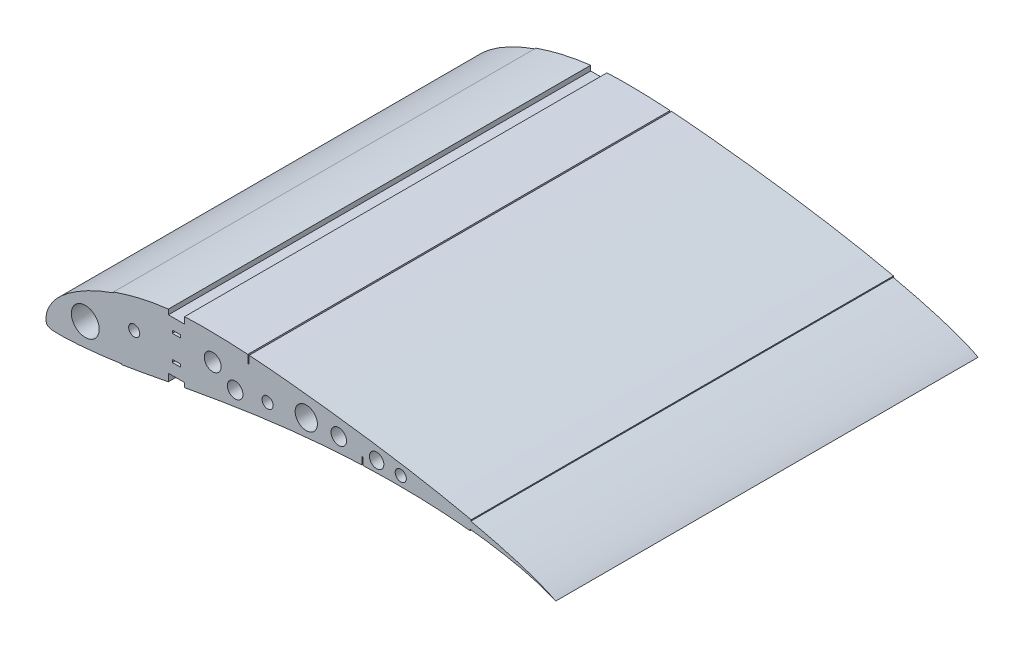
from build123d import *

# Parameters (mm, degrees)
BOSS_EXTRUDE1_DEPTH = 482.6
SKETCH2_R           = 15.90675
SKETCH2_W           = 9.525
SKETCH2_H           = 3.175
SKETCH2_W_2         = 18.415
SKETCH2_H_2         = 15.85559798
SKETCH2_H_3         = 15.855597979
SKETCH2_W_3         = 1.5875
SKETCH2_H_4         = 26.184180919
SKETCH2_H_5         = 17.627877955
CUT_EXTRUDE1_DEPTH  = 774.852233684
CUT_EXTRUDE2_DEPTH  = 774.852233684
SKETCH4_R           = 6.35
CUT_EXTRUDE3_DEPTH  = 254
SKETCH5_R           = 9.652
CUT_EXTRUDE4_DEPTH  = 762.304473176
SKETCH6_R           = 12.7
SKETCH6_R_2         = 8.89
SKETCH6_R_3         = 6.35
SKETCH6_R_4         = 8.255
CUT_EXTRUDE5_DEPTH  = 482.6


with BuildPart() as part:
    # Sketch1 → Boss-Extrude1 (new body)
    with BuildSketch(Plane.XY):
        with BuildLine():
            add(Edge.make_bspline(
                [(0.029973499, 1.067056553), (0.025482716, -0.399193593), (0.017346446, -3.055703366), (1.185340338, -7.066714799), (5.359349092, -9.058219245), (10.992299899, -9.337536048), (18.688970438, -9.608340666), (28.37164591, -9.190828627), (39.926779162, -8.423591432), (53.227271889, -7.19463679), (68.136511644, -5.531810338), (84.581964002, -3.399428713), (102.555539625, -0.419108309), (122.144766621, 3.318165226), (143.447572924, 7.385511412), (166.359833686, 11.680045868), (190.73763535, 16.023516172), (216.401946607, 20.252916976), (243.153661901, 24.227017525), (270.762236213, 27.800033502), (298.979393294, 30.867927352), (327.538585791, 33.292970979), (356.153214192, 35.012028405), (384.524332697, 35.957087661), (412.344151304, 36.076461373), (439.30234347, 35.362005472), (465.090056075, 33.83056325), (489.397768518, 31.501486873), (511.934144855, 28.465549934), (532.412164246, 24.806307195), (550.571231532, 20.660836314), (566.139870099, 16.190419061), (578.750416216, 11.518597391), (588.074753783, 6.996082262), (594.221404373, 3.366213471), (597.671198487, 1.186058119), (599.120636969, 0.230341997), (599.469973499, 0)],
                knots=[0, 0, 0, 0, 0.007209958, 0.013062794, 0.018988106, 0.028118167, 0.040671281, 0.056472504, 0.075356327, 0.097132941, 0.121590611, 0.148498573, 0.177976563, 0.210404303, 0.245731274, 0.283719641, 0.324062539, 0.366459866, 0.410534862, 0.455920904, 0.502185378, 0.548913178, 0.595654637, 0.641938473, 0.687301348, 0.731276985, 0.773403195, 0.813231176, 0.850309728, 0.884246489, 0.914622893, 0.941087891, 0.963171226, 0.980103797, 0.99153504, 0.997959817, 1, 1, 1, 1], degree=3))
            add(Edge.make_bspline(
                [(599.469973499, 0), (599.144367325, 0.249450159), (597.931629482, 1.178540797), (595.605930115, 3.282660064), (592.221856313, 6.473044338), (587.740102166, 10.189005153), (581.807923008, 13.823571972), (574.367601568, 17.383329981), (565.406953288, 21.084642776), (554.914604497, 24.893738904), (542.947936723, 28.777714393), (529.566323654, 32.704801784), (514.845570483, 36.655948851), (498.866688674, 40.595068593), (481.721371411, 44.49358753), (463.511784491, 48.327172983), (444.349131312, 52.07611226), (424.345406885, 55.694273937), (403.626579023, 59.176488272), (382.312051813, 62.47791518), (360.5396669, 65.605001309), (338.448959271, 68.532966072), (316.199932026, 71.252440139), (293.970449261, 73.78267886), (271.944537985, 76.059837779), (250.301639925, 78.041297276), (229.193973537, 79.615529991), (208.742113562, 80.698400053), (189.059840382, 81.1660338), (170.247983484, 81.116257243), (152.341634259, 80.195173727), (135.33385627, 78.328639474), (119.155414684, 75.689332361), (103.802404732, 72.270133295), (89.290599696, 68.260645439), (75.681399759, 63.73188295), (63.032687245, 58.789751147), (51.423050257, 53.460727999), (40.88976259, 47.853008536), (31.489987555, 42.03036159), (23.283138112, 36.071694919), (16.271085356, 30.103290726), (10.560360723, 24.060060491), (6.16261814, 17.994144061), (2.949517004, 12.093286108), (0.781951142, 6.489230076), (0.268908684, 2.789911015), (0.029973499, 1.067056553)],
                knots=[0, 0, 0, 0, 0.00192076, 0.007153976, 0.014672181, 0.023714055, 0.034360752, 0.047156029, 0.062313993, 0.079753134, 0.099422845, 0.121230508, 0.145063659, 0.170804284, 0.19830544, 0.227411767, 0.257957563, 0.289754565, 0.322619271, 0.356355351, 0.39077192, 0.425637579, 0.460722904, 0.495752348, 0.530423111, 0.564432121, 0.597540179, 0.629552894, 0.66034349, 0.689740734, 0.717642157, 0.744276208, 0.769837174, 0.794378837, 0.81790915, 0.840321993, 0.861526798, 0.881481099, 0.900117612, 0.9173823, 0.933224814, 0.947577749, 0.960450174, 0.972074093, 0.982555802, 0.991875852, 1, 1, 1, 1], degree=3))
        make_face()
    extrude(amount=BOSS_EXTRUDE1_DEPTH)

    # Sketch2 → Cut-Extrude1 (cut, through all)
    with BuildSketch(Plane(origin=(0, 0, 0), x_dir=(-1, 0, 0), z_dir=(0, 0, -1))):
        with Locations((-45.71378729, 19.209848511)):
            Circle(SKETCH2_R)
        with Locations((-149.86, 29.810016665)):
            Rectangle(SKETCH2_W, SKETCH2_H)
        with Locations((-149.86, 58.702516665)):
            Rectangle(SKETCH2_W, SKETCH2_H)
        with Locations((-149.86, 81.076565655)):
            Rectangle(SKETCH2_W_2, SKETCH2_H_2)
        with Locations((-149.86, 7.435967676)):
            Rectangle(SKETCH2_W_2, SKETCH2_H_3)
        with Locations((-232.18747961, 83.393527242)):
            Rectangle(SKETCH2_W_3, SKETCH2_H_4)
        with Locations((-362.485490244, 34.872384381)):
            Rectangle(SKETCH2_W_3, SKETCH2_H_5)
    extrude(amount=-CUT_EXTRUDE1_DEPTH, mode=Mode.SUBTRACT)

    # Sketch3 → Cut-Extrude2 (cut, through all)
    with BuildSketch(Plane.XY.offset(482.6)):
        with BuildLine():
            Line((77.933363518, 64.40769414), (78.1966121, 63.658868896))
            add(Edge.make_bspline(
                [(78.1966121, 63.658868896), (69.985634715, 60.772310029), (57.85648004, 55.846821377), (42.39425412, 47.834243761), (31.274486162, 41.004476131), (22.548835264, 34.510035421), (16.086911154, 28.733774419), (11.633751842, 24.01691432), (7.707609371, 18.860846034), (4.966930306, 14.226368594), (3.135747429, 10.32099561), (1.997147939, 7.315528892), (1.27047453, 4.249927301), (0.972190725, 2.082717901), (0.823556195, 1.011070007)],
                knots=[0.836254434, 0.836254434, 0.836254434, 0.836254434, 0.877169975, 0.897627745, 0.918085516, 0.938543286, 0.948772171, 0.959001057, 0.969229942, 0.979458827, 0.98457327, 0.989687712, 0.994802155, 0.999916597, 0.999916597, 0.999916597, 0.999916597], degree=3))
            add(Edge.make_bspline(
                [(0.823556195, 1.011070007), (0.822091374, 0.528862935), (0.819913396, -0.441566223), (0.87157268, -1.861096925), (1.028055129, -3.276582803), (1.336185442, -4.670302036), (1.856743185, -5.858463257), (2.880773306, -6.997470088), (5.091116011, -7.9581819), (7.851572867, -8.398591779), (11.735386514, -8.55832663), (16.643083098, -8.744170691), (22.490379014, -8.659168544), (28.366630918, -8.365820179), (34.240832229, -8.005847755), (40.109049075, -7.570305899), (45.97314136, -7.064913806), (53.787366325, -6.312731784), (63.544629774, -5.253187973), (75.237867071, -3.828913976), (83.008612285, -2.739497215), (86.887378889, -2.146354327)],
                knots=[8.7815e-05, 8.7815e-05, 8.7815e-05, 8.7815e-05, 0.002482783, 0.004877751, 0.007272718, 0.009667686, 0.012062654, 0.014457622, 0.019247558, 0.024037493, 0.028827429, 0.0384073, 0.047987172, 0.057567043, 0.067146914, 0.076726786, 0.086306657, 0.095886528, 0.115046271, 0.134206014, 0.153365756, 0.153365756, 0.153365756, 0.153365756], degree=3))
            Line((86.887378889, -2.146354327), (87.007364719, -2.930983196))
            add(Edge.make_bspline(
                [(0.029973499, 1.067056553), (0.025482716, -0.399193593), (0.017346446, -3.055703366), (1.185340338, -7.066714799), (5.359349092, -9.058219245), (10.992299899, -9.337536048), (18.688970438, -9.608340666), (28.37164591, -9.190828627), (39.926779162, -8.423591432), (53.227271889, -7.19463679), (68.136511644, -5.531810338), (79.575559776, -4.048578651), (86.020570323, -3.081884278), (87.007364719, -2.930983196)],
                knots=[0, 0, 0, 0, 0.007209958, 0.013062794, 0.018988106, 0.028118167, 0.040671281, 0.056472504, 0.075356327, 0.097132941, 0.121590611, 0.148498573, 0.153365756, 0.153365756, 0.153365756, 0.153365756], degree=3))
            add(Edge.make_bspline(
                [(77.933363518, 64.40769414), (77.113954255, 64.119631835), (72.031295812, 62.305706588), (63.032687245, 58.789751147), (51.423050257, 53.460727999), (40.88976259, 47.853008536), (31.489987555, 42.03036159), (23.283138112, 36.071694919), (16.271085356, 30.103290726), (10.560360723, 24.060060491), (6.16261814, 17.994144061), (2.949517004, 12.093286108), (0.781951142, 6.489230076), (0.268908684, 2.789911015), (0.029973499, 1.067056553)],
                knots=[0.836254434, 0.836254434, 0.836254434, 0.836254434, 0.840321993, 0.861526798, 0.881481099, 0.900117612, 0.9173823, 0.933224814, 0.947577749, 0.960450174, 0.972074093, 0.982555802, 0.991875852, 1, 1, 1, 1], degree=3))
        make_face()
        with BuildLine():
            Line((485.418851182, 31.793724256), (485.590124506, 33.371957983))
            add(Edge.make_bspline(
                [(485.590124506, 33.371957983), (493.893465776, 32.4708615), (510.464701197, 30.345194792), (535.15972241, 25.955207479), (555.516587627, 21.069581755), (571.517101052, 15.995789217), (579.362594494, 12.850321402), (583.182193169, 11.072832852)],
                knots=[0.805836244, 0.805836244, 0.805836244, 0.805836244, 0.846446639, 0.887057035, 0.92766743, 0.947972628, 0.968277825, 0.968277825, 0.968277825, 0.968277825], degree=3))
            add(Edge.make_bspline(
                [(583.182193169, 11.072832852), (581.384043053, 12.138030428), (577.690909224, 14.07350548), (569.977761779, 17.545570046), (560.108694843, 21.399429663), (548.042734666, 25.506594035), (531.778461633, 30.488573444), (511.222512963, 36.021440493), (494.638437991, 39.939557935), (486.326207629, 41.799049062)],
                knots=[0.031056695, 0.031056695, 0.031056695, 0.031056695, 0.041047331, 0.051037967, 0.071019239, 0.091000512, 0.110981784, 0.150944329, 0.190906873, 0.190906873, 0.190906873, 0.190906873], degree=3))
            Line((486.326207629, 41.799049062), (486.672774064, 43.348257878))
            add(Edge.make_bspline(
                [(599.469973499, 0), (599.144367325, 0.249450159), (597.931629482, 1.178540797), (595.605930115, 3.282660064), (592.221856313, 6.473044338), (587.740102166, 10.189005153), (581.807923008, 13.823571972), (574.367601568, 17.383329981), (565.406953288, 21.084642776), (554.914604497, 24.893738904), (542.947936723, 28.777714393), (529.566323654, 32.704801784), (514.845570483, 36.655948851), (500.400531408, 40.216945125), (490.861393011, 42.411241045), (486.672774064, 43.348257878)],
                knots=[0, 0, 0, 0, 0.00192076, 0.007153976, 0.014672181, 0.023714055, 0.034360752, 0.047156029, 0.062313993, 0.079753134, 0.099422845, 0.121230508, 0.145063659, 0.170804284, 0.190906873, 0.190906873, 0.190906873, 0.190906873], degree=3))
            add(Edge.make_bspline(
                [(485.418851182, 31.793724256), (486.926775542, 31.630081056), (495.991973516, 30.613163469), (511.934144855, 28.465549934), (532.412164246, 24.806307195), (550.571231532, 20.660836314), (566.139870099, 16.190419061), (578.750416216, 11.518597391), (588.074753783, 6.996082262), (594.221404373, 3.366213471), (597.671198487, 1.186058119), (599.120636969, 0.230341997), (599.469973499, 0)],
                knots=[0.805836244, 0.805836244, 0.805836244, 0.805836244, 0.813231176, 0.850309728, 0.884246489, 0.914622893, 0.941087891, 0.963171226, 0.980103797, 0.99153504, 0.997959817, 1, 1, 1, 1], degree=3))
        make_face()
    extrude(amount=-CUT_EXTRUDE2_DEPTH, mode=Mode.SUBTRACT)

    # Sketch4 → Cut-Extrude3 (cut)
    with BuildSketch(Plane.XY.offset(482.6)):
        with Locations((101.6, 38.1)):
            Circle(SKETCH4_R)
        with Locations((254, 43.18)):
            Circle(SKETCH4_R)
    extrude(amount=-CUT_EXTRUDE3_DEPTH, mode=Mode.SUBTRACT)

    # Sketch5 → Cut-Extrude4 (cut, through all)
    with BuildSketch(Plane.XY.offset(482.6)):
        with Locations((191.323556195, 51.811070007)):
            Circle(SKETCH5_R)
    extrude(amount=-CUT_EXTRUDE4_DEPTH, mode=Mode.SUBTRACT)

    # Sketch6 → Cut-Extrude5 (cut)
    with BuildSketch(Plane.XY.offset(482.6)):
        with Locations((298.228706277, 50.0531091)):
            Circle(SKETCH6_R)
        with Locations((335.350079168, 50.0531091)):
            Circle(SKETCH6_R_2)
        with Locations((406.202765834, 46.905785562)):
            Circle(SKETCH6_R_3)
        with Locations((378.603142123, 48.118012202)):
            Circle(SKETCH6_R_4)
        with Locations((216.977476475, 36.930482821)):
            Circle(SKETCH6_R_2)
    extrude(amount=-CUT_EXTRUDE5_DEPTH, mode=Mode.SUBTRACT)


solid = part.part
